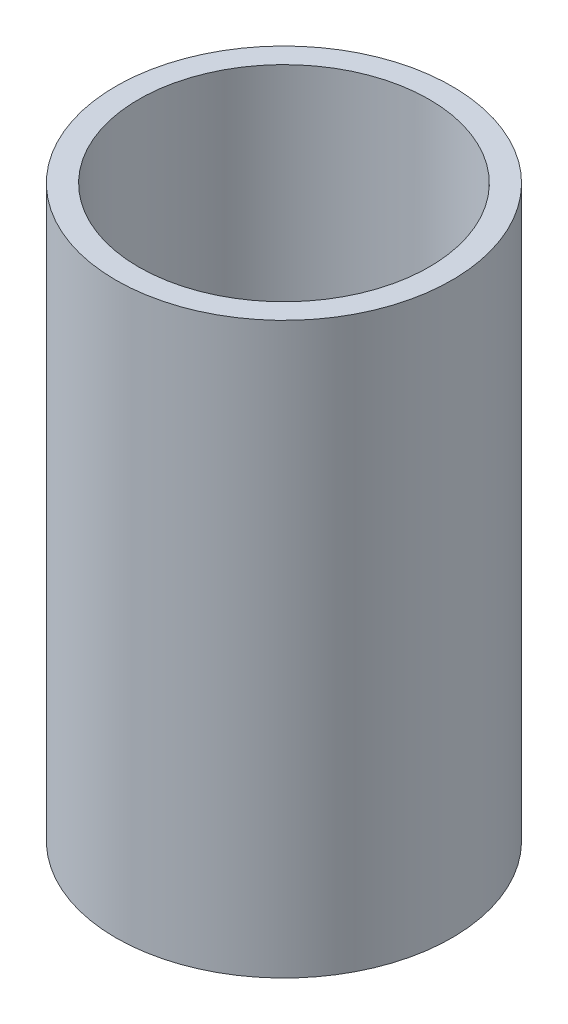
from build123d import *

# Parameters (mm, degrees)
SKETCH1_R           = 2.95
SKETCH1_R_2         = 2.55
BOSS_EXTRUDE1_DEPTH = 10
SKETCH2_R           = 1.5
CUT_EXTRUDE1_DEPTH  = 10


with BuildPart() as part:
    # Sketch1 → Boss-Extrude1 (new body)
    with BuildSketch(Plane(origin=(0, 0, 0), x_dir=(1, 0, 0), z_dir=(0, 1, 0))):
        with Locations(Location((0, 0, 0), (0, 0, 270))):
            Circle(SKETCH1_R)
        with Locations(Location((0, 0, 0), (0, 0, 270))):
            Circle(SKETCH1_R_2, mode=Mode.SUBTRACT)
    extrude(amount=BOSS_EXTRUDE1_DEPTH)

    # Sketch2 → Cut-Extrude1 (cut)
    with BuildSketch(Plane.XY):
        with Locations(Location((0, 4, 0), (0, 0, 90))):
            Circle(SKETCH2_R)
    extrude(amount=-CUT_EXTRUDE1_DEPTH, mode=Mode.SUBTRACT)


solid = part.part
